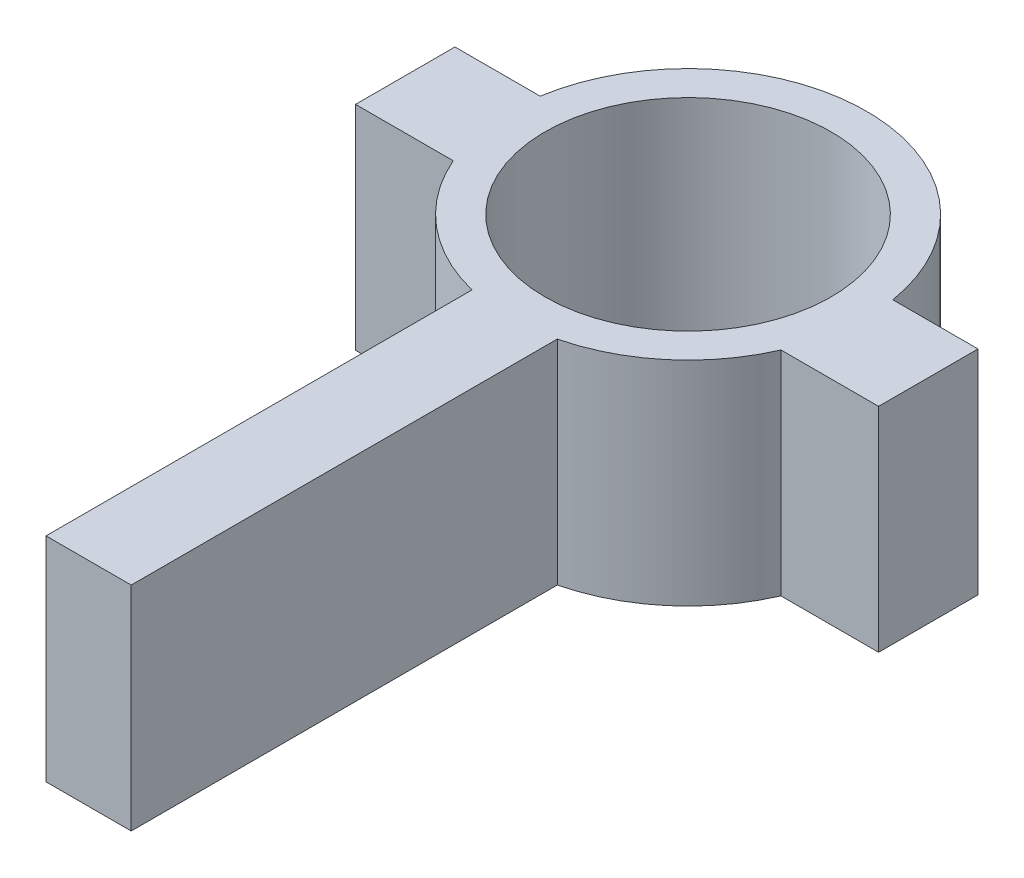
from build123d import *

# Parameters (mm, degrees)
SKETCH2_R           = 20.15
BOSS_EXTRUDE1_DEPTH = 30


with BuildPart() as part:
    # Sketch2 → Boss-Extrude1 (new body)
    with BuildSketch(Plane(origin=(0, 0, 0), x_dir=(1, 0, 0), z_dir=(0, 1, 0))):
        with BuildLine():
            Line((36.829871123, -10), (36.829871123, 4))
            Line((36.829871123, 4), (24.829871123, 4))
            ThreePointArc((24.829871123, 4), (0, 25.15), (-24.829871123, 4))
            Line((-24.829871123, 4), (-36.829871123, 4))
            Line((-36.829871123, 4), (-36.829871123, -10))
            Line((-36.829871123, -10), (-23.076449034, -10))
            ThreePointArc((-23.076449034, -10), (-16.228725969, -19.213301471), (-6, -24.423810104))
            Line((-6, -24.423810104), (-6, -84.423810104))
            Line((-6, -84.423810104), (6, -84.423810104))
            Line((6, -84.423810104), (6, -24.423810104))
            ThreePointArc((6, -24.423810104), (16.228725969, -19.213301471), (23.076449034, -10))
            Line((23.076449034, -10), (36.829871123, -10))
        make_face()
        with Locations(Location((0, 0, 0), (0, 0, 270))):
            Circle(SKETCH2_R, mode=Mode.SUBTRACT)
    extrude(amount=BOSS_EXTRUDE1_DEPTH)


solid = part.part
